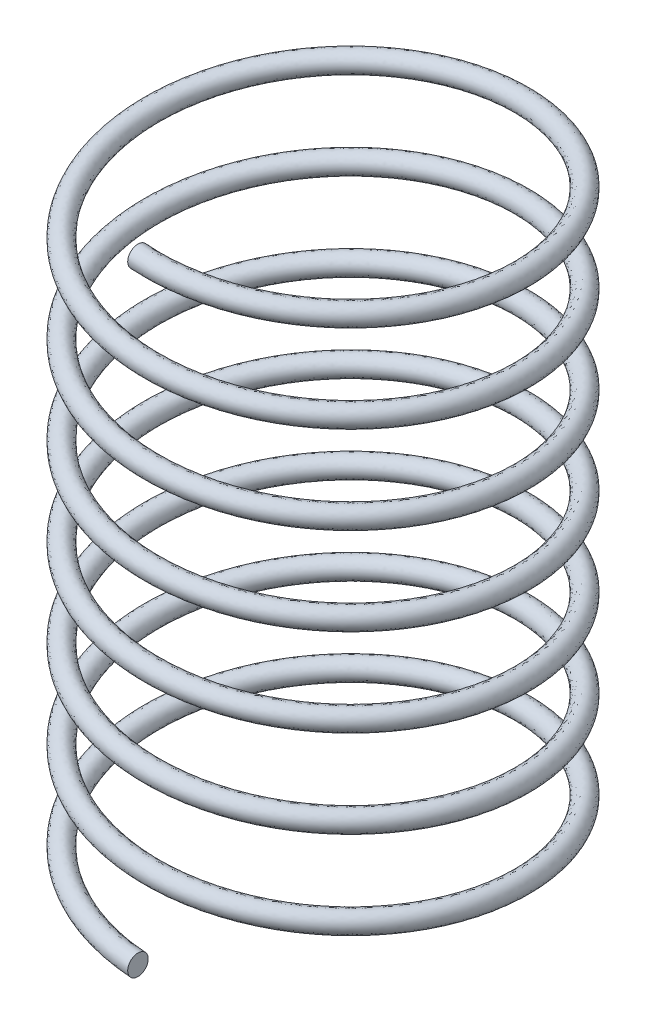
from build123d import *

# Parameters (mm, degrees)
SWEEP3_PITCH  = 25
SWEEP3_HEIGHT = 175
SWEEP3_RADIUS = 52.743172296
SKETCH12_R    = 2.925495086


with BuildPart() as part:
    # Sweep3: sweep along a helix
    with BuildLine() as sweep3_path:
        Helix(SWEEP3_PITCH, SWEEP3_HEIGHT, SWEEP3_RADIUS, center=(0, 0, 0), direction=(0, 1, 0), lefthand=True)
    # Sketch12 → Sweep3 (sweep)
    with BuildSketch(Plane(origin=(0, 0, 0), x_dir=(0, 0, -1), z_dir=(1, 0, 0))):
        with Locations((-52.743172296, 0)):
            Circle(SKETCH12_R)
    sweep(path=sweep3_path.line, is_frenet=True)


solid = part.part
